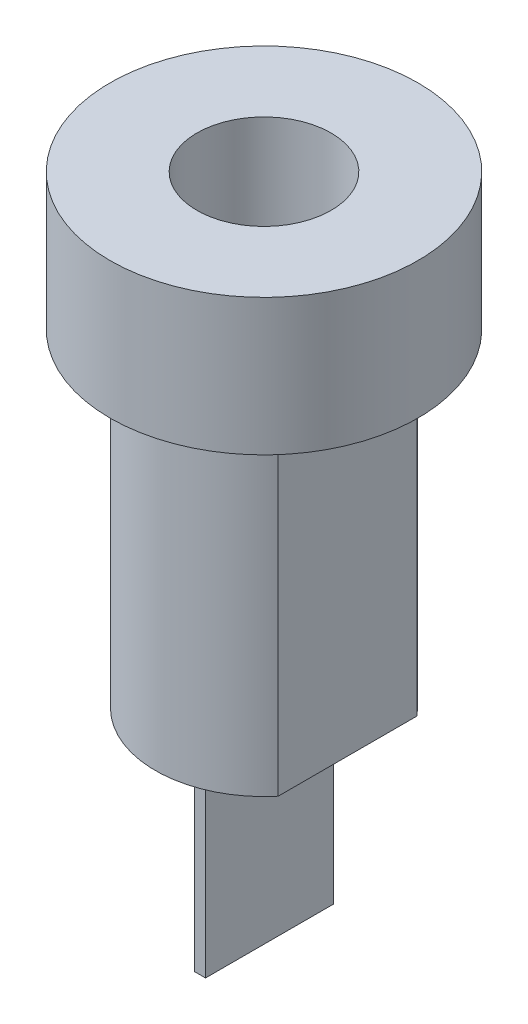
from build123d import *

# Parameters (mm, degrees)
CUT_EXTRUDE1_DEPTH  = 11.78
SKETCH3_W           = 0.4
SKETCH3_H           = 4.6
BOSS_EXTRUDE1_DEPTH = 7.15


with BuildPart() as part:
    # Sketch1 → Revolve1 (revolve)
    with BuildSketch(Plane(origin=(0, 0, 0), x_dir=(0, 0, -1), z_dir=(1, 0, 0)), mode=Mode.PRIVATE) as revolve1_sk:
        Polygon((-2.41, 16.68), (-5.53, 16.68), (-5.53, 11.78), (-3.9, 11.78), (-3.9, 0), (0, 0), (0, 11.78), (-2.41, 11.78), align=None)
    revolve(revolve1_sk.sketch.rotate(Axis((0, 0, 0), (0, 1, 0)), 180), axis=Axis((0, 0, 0), (0, 1, 0)))

    # Sketch2 → Cut-Extrude1 (cut)
    with BuildSketch(Plane.XZ):
        with BuildLine():
            Line((3, -2.491987159), (3, 2.491987159))
            ThreePointArc((3, 2.491987159), (3.9, 0), (3, -2.491987159))
        make_face()
        with BuildLine():
            Line((-3, 2.491987159), (-3, -2.491987159))
            ThreePointArc((-3, -2.491987159), (-3.9, 0), (-3, 2.491987159))
        make_face()
    extrude(amount=-CUT_EXTRUDE1_DEPTH, mode=Mode.SUBTRACT)

    # Sketch3 → Boss-Extrude1 (add)
    with BuildSketch(Plane.XZ):
        Rectangle(SKETCH3_W, SKETCH3_H)
    extrude(amount=BOSS_EXTRUDE1_DEPTH)


solid = part.part
